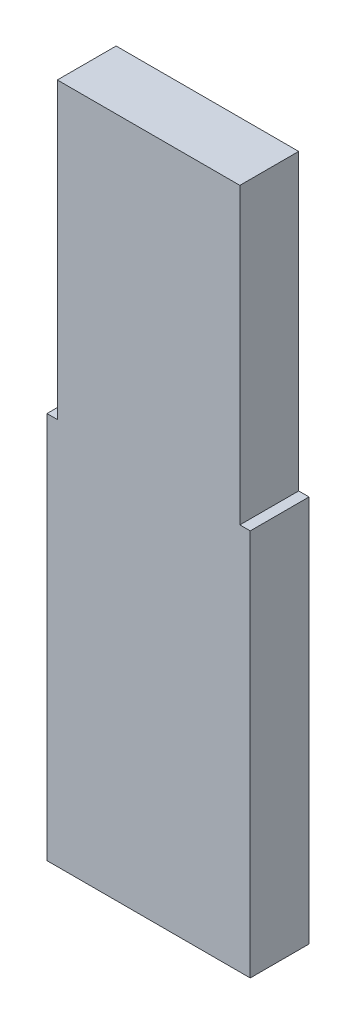
from build123d import *

# Parameters (mm, degrees)
BOSS_EXTRUDE1_DEPTH = 1.5875


with BuildPart() as part:
    # Sketch2 → Boss-Extrude1 (new, symmetric)
    with BuildSketch(Plane.XY):
        Polygon((40.805248532, -6.605939448), (50.659793871, -6.605939448), (50.659793871, -22.480939448), (51.218921201, -22.480939448), (51.218921201, -43.385139448), (40.246121201, -43.385139448), (40.246121201, -22.480939448), (40.805248532, -22.480939448), align=None)
    extrude(amount=BOSS_EXTRUDE1_DEPTH, both=True)


solid = part.part
